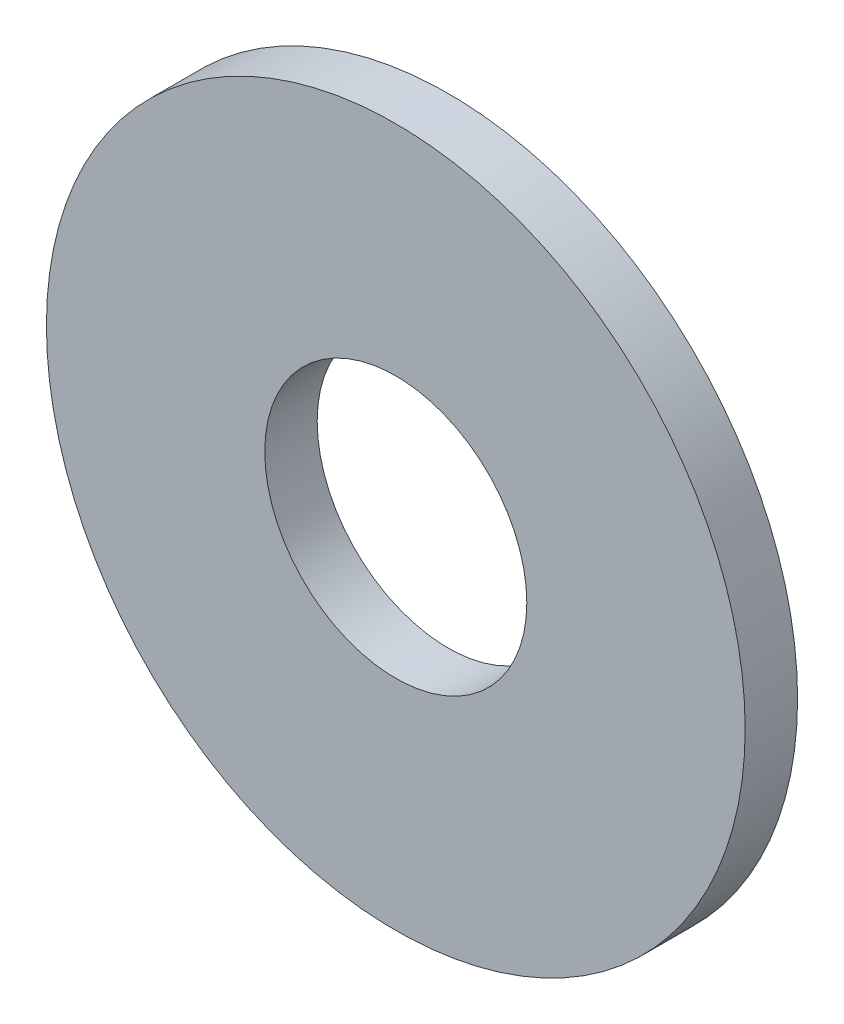
from build123d import *

# Parameters (mm, degrees)
SKETCH1_R           = 40
SKETCH1_R_2         = 15
BOSS_EXTRUDE1_DEPTH = 6


with BuildPart() as part:
    # Sketch1 → Boss-Extrude1 (new body)
    with BuildSketch(Plane.XY):
        Circle(SKETCH1_R)
        Circle(SKETCH1_R_2, mode=Mode.SUBTRACT)
    extrude(amount=BOSS_EXTRUDE1_DEPTH)


solid = part.part
